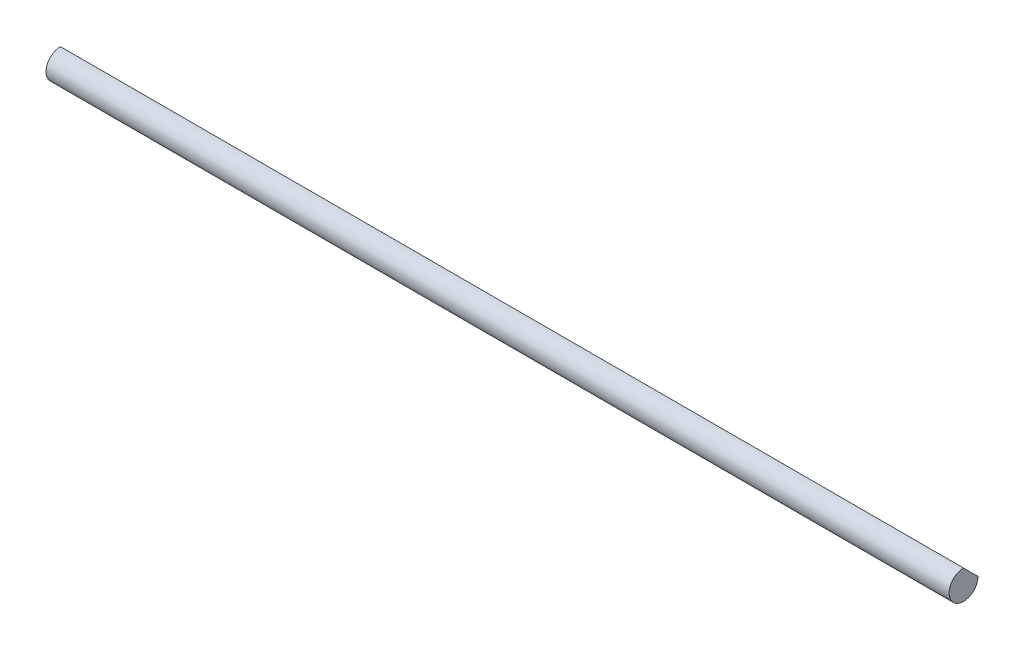
from build123d import *

# Parameters (mm, degrees)
EXTRUDE_1_DEPTH = 125


with BuildPart() as part:
    # 草图1 → 凸台-拉伸1 (new body)
    with BuildSketch(Plane(origin=(0, 0, 0), x_dir=(0, 0, -1), z_dir=(1, 0, 0))):
        with BuildLine():
            Line((0, 2), (2, 0))
            ThreePointArc((2, 0), (-1.414213562, -1.414213562), (0, 2))
        make_face()
    extrude(amount=EXTRUDE_1_DEPTH)


solid = part.part
